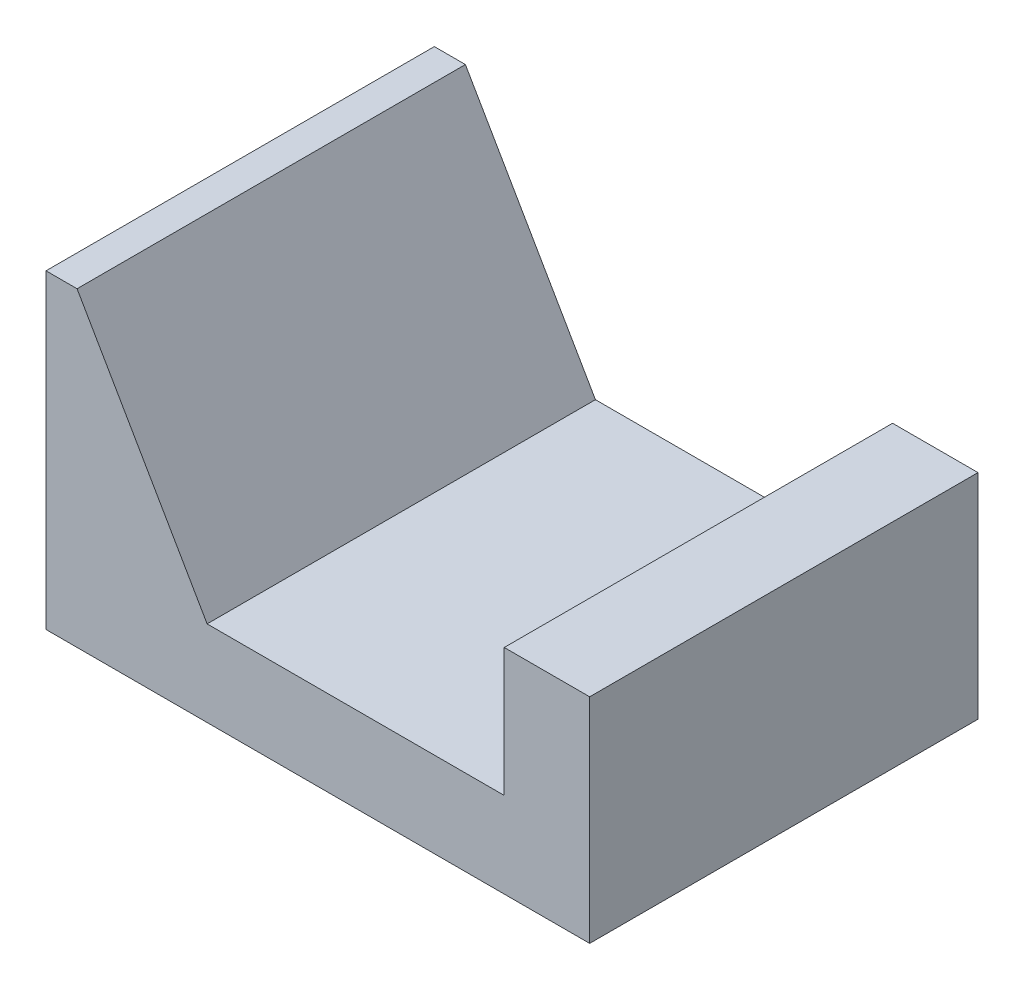
from build123d import *

# Parameters (mm, degrees)
SKETCH_4_W      = 56
SKETCH_4_H      = 40
EXTRUDE_2_DEPTH = 8.8
SKETCH_5_W      = 8.8
SKETCH_5_H      = 13.2
EXTRUDE_3_DEPTH = 40


with BuildPart() as part:
    # 스케치4 → 보스-돌출2 (new body)
    with BuildSketch(Plane(origin=(0, 0, 0), x_dir=(1, 0, 0), z_dir=(0, 1, 0))):
        with Locations((28, 20)):
            Rectangle(SKETCH_4_W, SKETCH_4_H)
    extrude(amount=EXTRUDE_2_DEPTH)

    # 스케치5 → 보스-돌출3 (add)
    with BuildSketch(Plane.XY):
        Polygon((0, 8.8), (0, 32), (3.2, 32), (16.594526245, 8.8), align=None)
        with Locations((51.6, 15.4)):
            Rectangle(SKETCH_5_W, SKETCH_5_H)
    extrude(amount=-EXTRUDE_3_DEPTH)


solid = part.part
